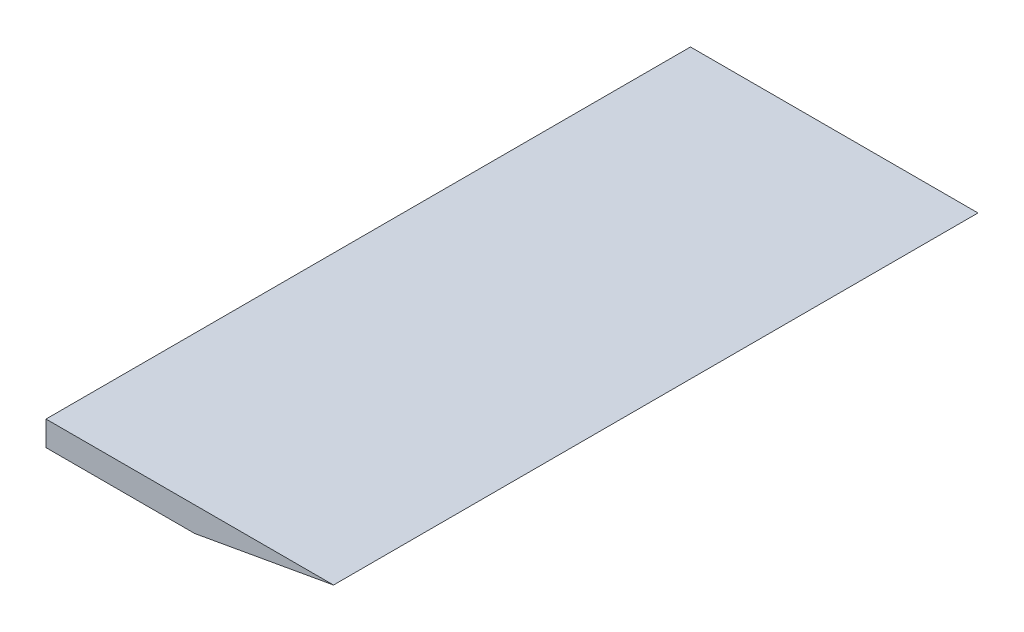
from build123d import *

# Parameters (mm, degrees)
BOSS_EXTRUDE1_DEPTH = 130


with BuildPart() as part:
    # Sketch1 → Boss-Extrude1 (new body)
    with BuildSketch(Plane.XY):
        Polygon((0, 0), (58, 0), (30, -5), (0, -5), align=None)
    extrude(amount=BOSS_EXTRUDE1_DEPTH)


solid = part.part
